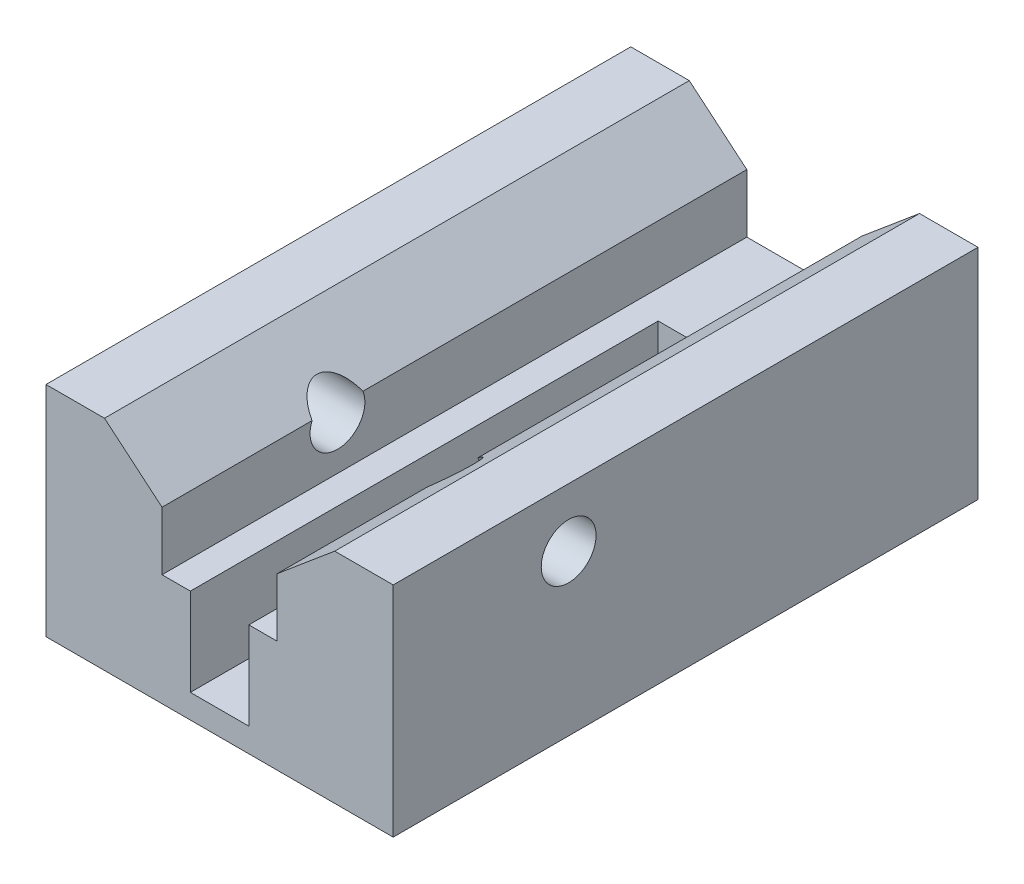
from build123d import *

# Parameters (mm, degrees)
BOSS_EXTRUDE2_DEPTH = 25.4
SKETCH3_W           = 2.54
SKETCH3_H           = 20.32
CUT_EXTRUDE1_DEPTH  = 3.81
SKETCH4_R           = 1.190625
CUT_EXTRUDE2_DEPTH  = 30.934976745


with BuildPart() as part:
    # Sketch2 → Boss-Extrude2 (new body)
    with BuildSketch(Plane.XY):
        Polygon((-5, 4.637749078), (-7.54, 4.637749078), (-7.54, -4.851436151), (7.54, -4.851436151), (7.54, 4.637749078), (5, 4.637749078), (2.5, 2.54), (2.5, 0), (-2.5, 0), (-2.5, 2.54), align=None)
    extrude(amount=BOSS_EXTRUDE2_DEPTH)

    # Sketch3 → Cut-Extrude1 (cut)
    with BuildSketch(Plane(origin=(0, 0, 0), x_dir=(1, 0, 0), z_dir=(0, 1, 0))):
        with Locations((0, -15.24)):
            Rectangle(SKETCH3_W, SKETCH3_H)
    extrude(amount=-CUT_EXTRUDE1_DEPTH, mode=Mode.SUBTRACT)

    # Sketch4 → Cut-Extrude2 (cut, through all)
    with BuildSketch(Plane(origin=(7.54, 0, 0), x_dir=(0, 0, -1), z_dir=(1, 0, 0))):
        with Locations(Location((-17.78, 2.097749078, 0), (0, 0, 90))):
            Circle(SKETCH4_R)
    extrude(amount=-CUT_EXTRUDE2_DEPTH, mode=Mode.SUBTRACT)


solid = part.part
